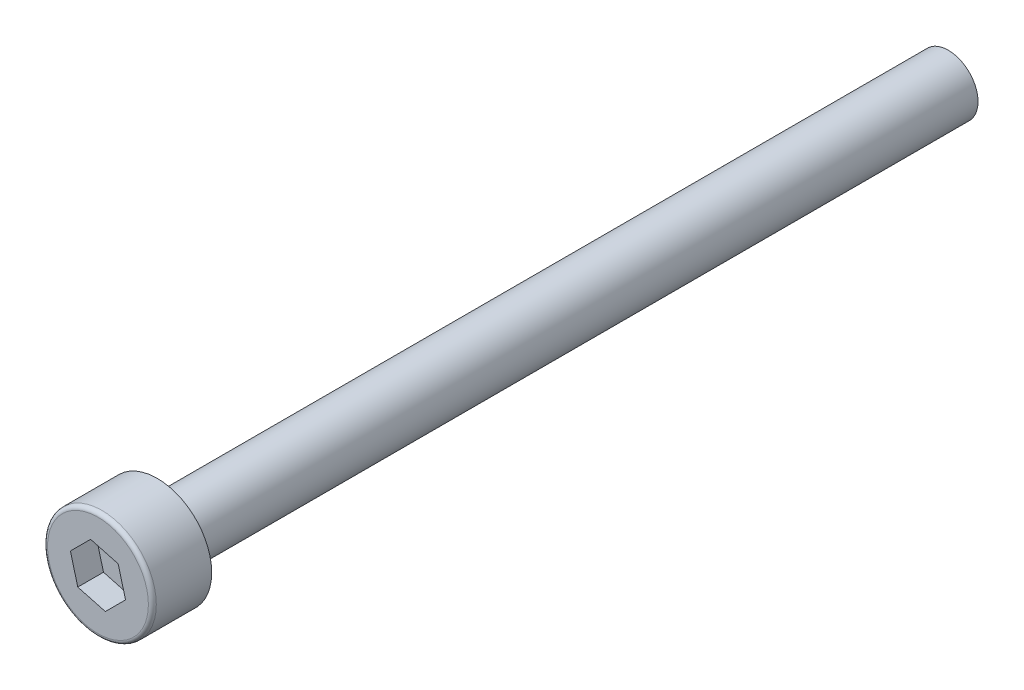
from build123d import *

# Parameters (mm, degrees)
SKETCH_1_R          = 2.75
EXTRUDE_1_DEPTH     = 3
CUT_EXTRUDE_1_DEPTH = 1.3
SKETCH_3_R          = 1.5
EXTRUDE_2_DEPTH     = 40
FILLET_1_R          = 0.2


with BuildPart() as part:
    # 草图1 → 凸台-拉伸1 (new body)
    with BuildSketch(Plane.XY):
        Circle(SKETCH_1_R)
    extrude(amount=EXTRUDE_1_DEPTH)

    # 草图2 → 切除-拉伸1 (cut)
    with BuildSketch(Plane.XY.offset(3)):
        Polygon((-1.020620726, -1.020620726), (0.373573113, -1.39419384), (1.39419384, -0.373573113), (1.020620726, 1.020620726), (-0.373573113, 1.39419384), (-1.39419384, 0.373573113), align=None)
    extrude(amount=-CUT_EXTRUDE_1_DEPTH, mode=Mode.SUBTRACT)

    # 草图3 → 凸台-拉伸2 (add)
    with BuildSketch(Plane(origin=(0, 0, 0), x_dir=(-1, 0, 0), z_dir=(0, 0, -1))):
        with Locations(Location((0, 0, 0), (0, 0, 180))):
            Circle(SKETCH_3_R)
    extrude(amount=EXTRUDE_2_DEPTH)

    # 圆角1
    fillet_1_edges = [part.edges().sort_by_distance(p)[0] for p in [
        (-2.75, 0, 3),
    ]]
    fillet(fillet_1_edges, radius=FILLET_1_R)


solid = part.part
